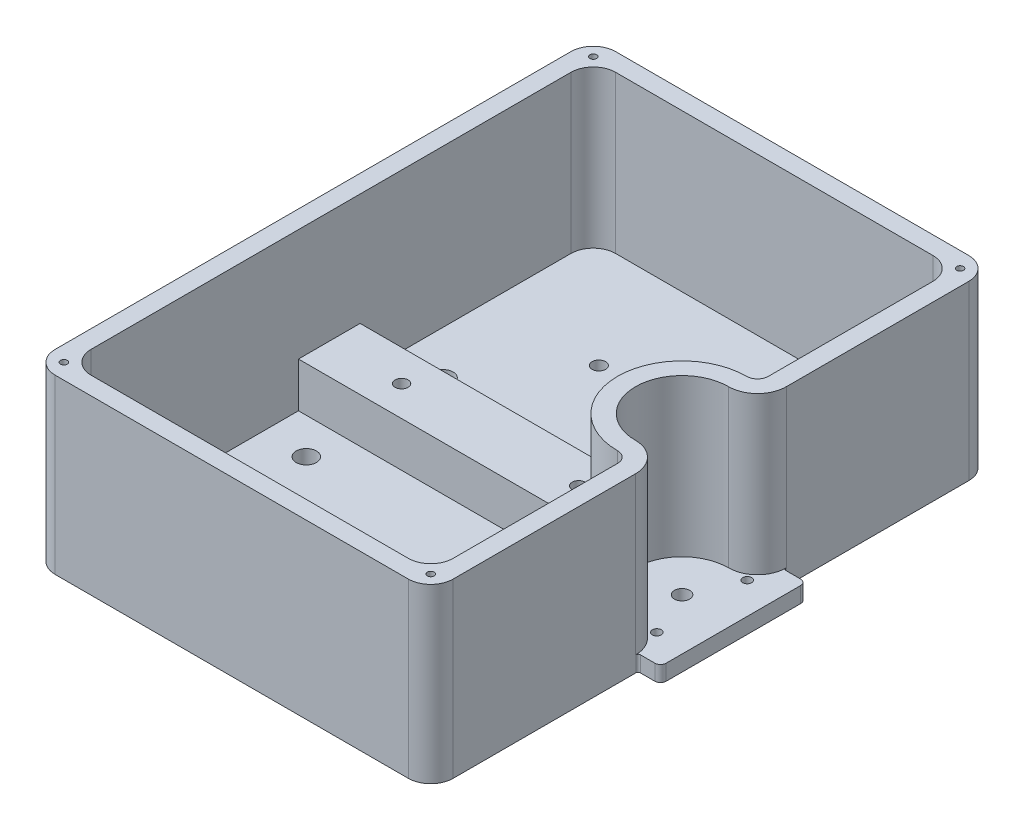
from build123d import *

# Parameters (mm, degrees)
CROQUIS1_W                                           = 177.5
CROQUIS1_H                                           = 250
CROQUIS1_R                                           = 2
CROQUIS1_R_2                                         = 3.4
CROQUIS1_R_3                                         = 3
CROQUIS1_R_4                                         = 4.5
SALIENTE_EXTRUIR1_DEPTH                              = 7
SALIENTE_EXTRUIR2_DEPTH                              = 70
REDONDEO1_R                                          = 10
CROQUIS4_W                                           = 10
CROQUIS4_H                                           = 65
SALIENTE_EXTRUIR3_DEPTH                              = 7
REDONDEO3_R                                          = 1
REDONDEO4_R                                          = 2.5
CROQUIS5_W                                           = 121
CROQUIS5_H                                           = 27.5
SALIENTE_EXTRUIR4_DEPTH                              = 20
AVELLANADO_PARA_TORNILLO_CON_CABEZA_OVAL_D           = 5.7912
AVELLANADO_PARA_TORNILLO_CON_CABEZA_OVAL_CSINK_D     = 11.1252
AVELLANADO_PARA_TORNILLO_CON_CABEZA_OVAL_CSINK_ANGLE = 82
CROQUIS15_R                                          = 1.5
CORTAR_EXTRUIR1_DEPTH                                = 5


with BuildPart() as part:
    # Croquis1 → Saliente-Extruir1 (new body)
    with BuildSketch(Plane(origin=(0, 4, 0), x_dir=(1, 0, 0), z_dir=(0, 1, 0))):
        with Locations((68.75, 0)):
            Rectangle(CROQUIS1_W, CROQUIS1_H)
        with Locations(Location((153.5, -20.15, 0), (0, 0, 90))):
            Circle(CROQUIS1_R, mode=Mode.SUBTRACT)
        with Locations(Location((144.6, 0, 0), (0, 0, 90))):
            Circle(CROQUIS1_R_2, mode=Mode.SUBTRACT)
        with Locations(Location((153.5, 20.15, 0), (0, 0, 90))):
            Circle(CROQUIS1_R, mode=Mode.SUBTRACT)
        with Locations(Location((37.5, 70, 0), (0, 0, 90))):
            Circle(CROQUIS1_R_3, mode=Mode.SUBTRACT)
        with Locations(Location((37.5, -70, 0), (0, 0, 90))):
            Circle(CROQUIS1_R_3, mode=Mode.SUBTRACT)
        with Locations(Location((7.5, -30.5, 0), (0, 0, 90))):
            Circle(CROQUIS1_R_4, mode=Mode.SUBTRACT)
        with Locations(Location((7.5, 30.5, 0), (0, 0, 90))):
            Circle(CROQUIS1_R_4, mode=Mode.SUBTRACT)
    extrude(amount=SALIENTE_EXTRUIR1_DEPTH)

    # Croquis3 → Saliente-Extruir2 (add)
    with BuildSketch(Plane(origin=(0, 11, 0), x_dir=(1, 0, 0), z_dir=(0, 1, 0))):
        with BuildLine():
            Line((-20, 125), (-20, -125))
            Line((-20, -125), (157.5, -125))
            Line((157.5, -125), (157.5, -33.65))
            ThreePointArc((157.5, -33.65), (153.721677477, -24.528322523), (144.6, -20.75))
            ThreePointArc((144.6, -20.75), (123.85, 0), (144.6, 20.75))
            ThreePointArc((144.6, 20.75), (153.721677477, 24.528322523), (157.5, 33.65))
            Line((157.5, 33.65), (157.5, 125))
            Line((157.5, 125), (-20, 125))
        make_face()
        with BuildLine():
            Line((149.5, 117), (-12, 117))
            Line((-12, 117), (-12, -117))
            Line((-12, -117), (149.5, -117))
            Line((149.5, -117), (149.5, -33.65))
            ThreePointArc((149.5, -33.65), (148.064823228, -30.185176772), (144.6, -28.75))
            ThreePointArc((144.6, -28.75), (115.85, 0), (144.6, 28.75))
            ThreePointArc((144.6, 28.75), (148.064823228, 30.185176772), (149.5, 33.65))
            Line((149.5, 33.65), (149.5, 117))
        make_face(mode=Mode.SUBTRACT)
    extrude(amount=SALIENTE_EXTRUIR2_DEPTH)

    # Redondeo1
    redondeo1_edges = [part.edges().sort_by_distance(p)[0] for p in [
        (-12, 46, 117),
        (149.5, 46, 117),
        (149.5, 46, -117),
        (-12, 46, -117),
        (-20, 42.5, -125),
        (157.5, 42.5, -125),
        (157.5, 42.5, 125),
        (-20, 42.5, 125),
    ]]
    fillet(redondeo1_edges, radius=REDONDEO1_R)

    # Croquis4 → Saliente-Extruir3 (add)
    with BuildSketch(Plane(origin=(0, 11, 0), x_dir=(1, 0, 0), z_dir=(0, 1, 0))):
        with Locations((162.5, 0)):
            Rectangle(CROQUIS4_W, CROQUIS4_H)
    extrude(amount=-SALIENTE_EXTRUIR3_DEPTH)

    # Redondeo3
    redondeo3_edges = [part.edges().sort_by_distance(p)[0] for p in [
        (157.5, 7.5, -32.5),
        (157.5, 7.5, 32.5),
    ]]
    fillet(redondeo3_edges, radius=REDONDEO3_R)

    # Redondeo4
    redondeo4_edges = [part.edges().sort_by_distance(p)[0] for p in [
        (167.5, 7.5, -32.5),
        (167.5, 7.5, 32.5),
    ]]
    fillet(redondeo4_edges, radius=REDONDEO4_R)

    # Croquis5 → Saliente-Extruir4 (add)
    with BuildSketch(Plane(origin=(0, 11, 0), x_dir=(1, 0, 0), z_dir=(0, 1, 0))):
        with Locations((48.5, -0.75)):
            Rectangle(CROQUIS5_W, CROQUIS5_H)
        with Locations((48.5, -93.25)):
            Rectangle(CROQUIS5_W, CROQUIS5_H)
    extrude(amount=SALIENTE_EXTRUIR4_DEPTH)

    # Avellanado para tornillo con cabeza ovalada de #121 (through all)
    with Locations(Plane(origin=(0, 4, 0), x_dir=(-1, 0, 0), z_dir=(0, -1, 0))):
        with Locations((-99.5, -93), (-20.5, -92.999999989), (-20.5, -0.999999991), (-99.5, -1)):
            CounterSinkHole(AVELLANADO_PARA_TORNILLO_CON_CABEZA_OVAL_D / 2, AVELLANADO_PARA_TORNILLO_CON_CABEZA_OVAL_CSINK_D / 2, counter_sink_angle=AVELLANADO_PARA_TORNILLO_CON_CABEZA_OVAL_CSINK_ANGLE)

    # Croquis15 → Cortar-Extruir1 (cut)
    with BuildSketch(Plane(origin=(0, 81, 0), x_dir=(1, 0, 0), z_dir=(0, 1, 0))):
        with Locations(Location((150.571067812, -118.071067812, 0), (0, 0, 270))):
            Circle(CROQUIS15_R)
        with Locations(Location((-13.071067812, -118.071067812, 0), (0, 0, 270))):
            Circle(CROQUIS15_R)
        with Locations(Location((-13.071067812, 118.071067812, 0), (0, 0, 90))):
            Circle(CROQUIS15_R)
        with Locations(Location((150.571067812, 118.071067812, 0), (0, 0, 90))):
            Circle(CROQUIS15_R)
    extrude(amount=-CORTAR_EXTRUIR1_DEPTH, mode=Mode.SUBTRACT)


solid = part.part
